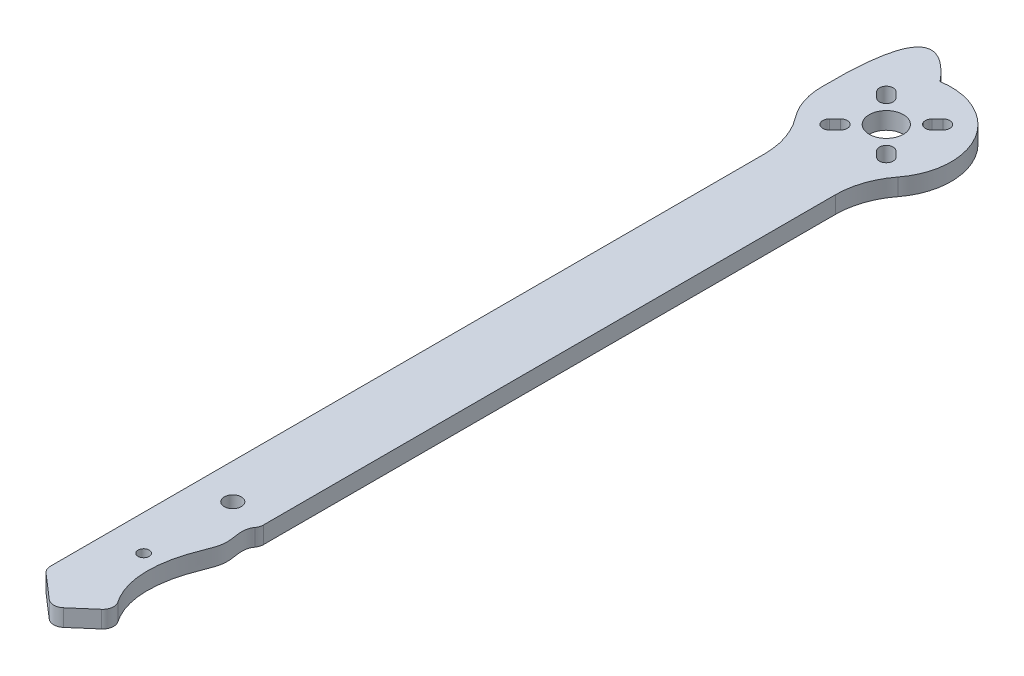
from build123d import *

# Parameters (mm, degrees)
BOSS_EXTRUDE1_DEPTH = 1.984375
FILLET1_R           = 17.779999999999998
FILLET3_R           = 2.54


with BuildPart() as part:
    # Sketch1 → Boss-Extrude1 (new, symmetric)
    # profile 1 of 7: a face of its own
    with BuildSketch(Plane(origin=(0, 0, 0), x_dir=(1, 0, 0), z_dir=(0, 1, 0))):
        with BuildLine():
            Line((-8.23515625000002, 7.14375), (0, 7.14375))
            Line((0, 7.14375), (0, 20.43906250000001))
            ThreePointArc((-1.513e-14, 20.43906250000001), (-1.2898437499999995, 21.72890625000001), (-1.567e-14, 23.018750000000008))
            Line((0, 23.018750000000008), (0, 40.48125000000001))
            ThreePointArc((6.485e-14, 40.48125000000001), (-1.984375, 42.46562500000001), (6.445e-14, 44.45000000000001))
            Line((0, 44.45000000000001), (0, 179.38750000000002))
            ThreePointArc((3.455e-13, 179.38750000000002), (-4.295498058784434, 180.01216679408725), (-8.235156249999983, 181.83441966156948))
            Line((-8.235156250000001, 181.83441966156946), (-8.235156250000022, 7.143750000000011))
        make_face()
    # profile 2 of 7: a face of its own
    with BuildSketch(Plane(origin=(0, 0, 0), x_dir=(1, 0, 0), z_dir=(0, 1, 0))):
        with BuildLine():
            Line((0, 20.43906250000001), (0, 7.14375))
            Line((0, 7.14375), (8.23515625000002, 7.14375))
            add(Edge.make_bspline(
                [(8.235156250000017, 40.44394804447435), (6.159687598359963, 38.37781946383395), (8.44847607791561, 34.0776706590483), (3.312171002640199, 23.23056643102504), (2.7641627847252086, 13.194656625268534), (8.23515625000002, 7.143749999999999)],
                knots=[0, 0, 0, 0, 0.20223780839821387, 0.3558357267481405, 1, 1, 1, 1], degree=3))
            Line((8.235156250000017, 40.443948044474354), (8.235156250000001, 181.83441966156946))
            ThreePointArc((8.23515624999998, 181.83441966156948), (4.295498058784762, 180.01216679408734), (3.455e-13, 179.38750000000002))
            Line((0, 179.38750000000002), (0, 44.45000000000001))
            ThreePointArc((6.445e-14, 44.45000000000001), (1.4031650189170781, 43.86879001891704), (1.984375, 42.46562500000001))
            ThreePointArc((1.984375, 42.46562500000001), (1.4031650189170788, 41.06245998108298), (6.485e-14, 40.48125000000001))
            Line((0, 40.48125000000001), (0, 23.018750000000008))
            ThreePointArc((-1.567e-14, 23.018750000000008), (0.9120572622960801, 22.6409635122961), (1.2898437499999995, 21.72890625000001))
            ThreePointArc((1.2898437499999995, 21.72890625000001), (0.9120572622960798, 20.816848987703917), (-1.513e-14, 20.43906250000001))
        make_face()
    # profile 3 of 7: a face of its own
    with BuildSketch(Plane(origin=(0, 0, 0), x_dir=(1, 0, 0), z_dir=(0, 1, 0))):
        Polygon((-8.23515625000002, 7.14375), (0, -8.9e-16), (0, 7.14375), align=None)
    # profile 4 of 7: a face of its own
    with BuildSketch(Plane(origin=(0, 0, 0), x_dir=(1, 0, 0), z_dir=(0, 1, 0))):
        Polygon((0, 7.14375), (0, 0), (8.23515625000002, 7.14375), align=None)
    # profile 5 of 7: a face of its own
    with BuildSketch(Plane(origin=(0, 0, 0), x_dir=(1, 0, 0), z_dir=(0, 1, 0))):
        with BuildLine():
            ThreePointArc((-15.081249999999988, 194.46875), (-13.259723823628677, 187.2837777882518), (-8.235156249999983, 181.83441966156948))
            ThreePointArc((-8.235156249999983, 181.83441966156948), (-4.295498058784434, 180.01216679408725), (3.455e-13, 179.38750000000002))
            Line((0, 179.38750000000002), (0, 190.5))
            ThreePointArc((3.1e-14, 190.5), (-3.96874999999999, 194.46875), (3.197e-14, 198.4375))
            Line((0, 198.4375), (0, 209.54999999999998))
            ThreePointArc((9.2e-16, 209.54999999999998), (-1.1963495653314102, 209.50247373299547), (-2.3851589030460536, 209.3601944755947))
            ThreePointArc((-2.3851589030460536, 209.3601944755947), (-11.476394888401645, 204.2532511077708), (-15.081249999999988, 194.46875))
        make_face()
        with BuildLine():
            Line((-7.717407604043602, 188.99640642622387), (-6.454559087018252, 190.25925494324918))
            ThreePointArc((-6.45455908701825, 190.25925494324918), (-4.209495056750905, 190.25925494324918), (-4.20949505675094, 188.01419091298183))
            Line((-4.209495056750945, 188.01419091298183), (-5.472343573776267, 186.7513423959565))
            ThreePointArc((-5.472343573776268, 186.7513423959565), (-7.717407604043627, 186.75134239595653), (-7.717407604043606, 188.99640642622387))
        make_face(mode=Mode.SUBTRACT)
        with BuildLine():
            Line((-5.472343573776115, 202.1861576040435), (-4.209495056750815, 200.92330908701817))
            ThreePointArc((-4.209495056750815, 200.92330908701817), (-4.209495056750835, 198.67824505675082), (-6.454559087018169, 198.67824505675088))
            Line((-6.454559087018169, 198.67824505675088), (-7.717407604043481, 199.94109357377621))
            ThreePointArc((-7.717407604043492, 199.94109357377621), (-7.717407604043447, 202.18615760404353), (-5.472343573776121, 202.1861576040435))
        make_face(mode=Mode.SUBTRACT)
    # profile 6 of 7: a face of its own
    with BuildSketch(Plane(origin=(0, 0, 0), x_dir=(1, 0, 0), z_dir=(0, 1, 0))):
        with BuildLine():
            Line((0, 190.5), (0, 179.38750000000002))
            ThreePointArc((3.455e-13, 179.38750000000002), (4.295498058784762, 180.01216679408734), (8.23515624999998, 181.83441966156948))
            ThreePointArc((8.23515624999998, 181.83441966156948), (13.259723823628674, 187.2837777882518), (15.081249999999988, 194.46875))
            ThreePointArc((15.081249999999988, 194.46875), (10.664054143769611, 205.13280414376962), (9.2e-16, 209.54999999999998))
            Line((0, 209.54999999999998), (0, 198.4375))
            ThreePointArc((3.197e-14, 198.4375), (2.8063300378341145, 197.2750800378341), (3.96874999999999, 194.46875))
            ThreePointArc((3.96874999999999, 194.46875), (2.806330037834115, 191.6624199621659), (3.1e-14, 190.5))
        make_face()
        with BuildLine():
            ThreePointArc((4.209495056750873, 188.0141909129818), (4.209495056750863, 190.25925494324915), (6.454559087018207, 190.25925494324912))
            Line((6.454559087018202, 190.25925494324912), (7.717407604043522, 188.99640642622379))
            ThreePointArc((7.717407604043532, 188.99640642622379), (7.717407604043521, 186.75134239595644), (5.472343573776178, 186.75134239595644))
            Line((5.472343573776174, 186.75134239595644), (4.209495056750864, 188.0141909129818))
        make_face(mode=Mode.SUBTRACT)
        with BuildLine():
            Line((7.717407604043602, 199.9410935737761), (6.454559087018252, 198.6782450567508))
            ThreePointArc((6.454559087018261, 198.6782450567508), (4.209495056750886, 198.67824505675077), (4.209495056750962, 200.92330908701814))
            Line((4.209495056750945, 200.92330908701817), (5.472343573776294, 202.18615760404347))
            ThreePointArc((5.472343573776303, 202.18615760404347), (7.7174076040436335, 202.18615760404342), (7.717407604043618, 199.94109357377607))
        make_face(mode=Mode.SUBTRACT)
    # profile 7 of 7: a face of its own
    with BuildSketch(Plane(origin=(0, 0, 0), x_dir=(1, 0, 0), z_dir=(0, 1, 0))):
        with BuildLine():
            add(Edge.make_bspline(
                [(-15.081249999999988, 194.46875), (-15.572644055765616, 225.099567963449), (-2.385158903046056, 209.3601944755947)],
                knots=[0, 0, 0, 1, 1, 1], degree=2))
            ThreePointArc((-15.081249999999988, 194.46875), (-11.476394888401645, 204.2532511077708), (-2.3851589030460536, 209.3601944755947))
        make_face()
    extrude(amount=BOSS_EXTRUDE1_DEPTH, both=True)

    # Fillet1
    fillet1_edges = [part.edges().sort_by_distance(p)[0] for p in [
        (-8.235156249999992, 0, -181.83441966156948),
        (8.235156249999992, 0, -181.83441966156948),
    ]]
    fillet(fillet1_edges, radius=FILLET1_R)

    # Fillet3
    fillet3_edges = [part.edges().sort_by_distance(p)[0] for p in [
        (8.235156250000017, -0.9921875, -40.443948044474354),
        (-8.23515625000002, 0, -7.143750000000006),
        (0, 0, 4.4e-16),
        (8.23515625000002, 0.9921875, -7.143749999999999),
    ]]
    fillet(fillet3_edges, radius=FILLET3_R)


solid = part.part
